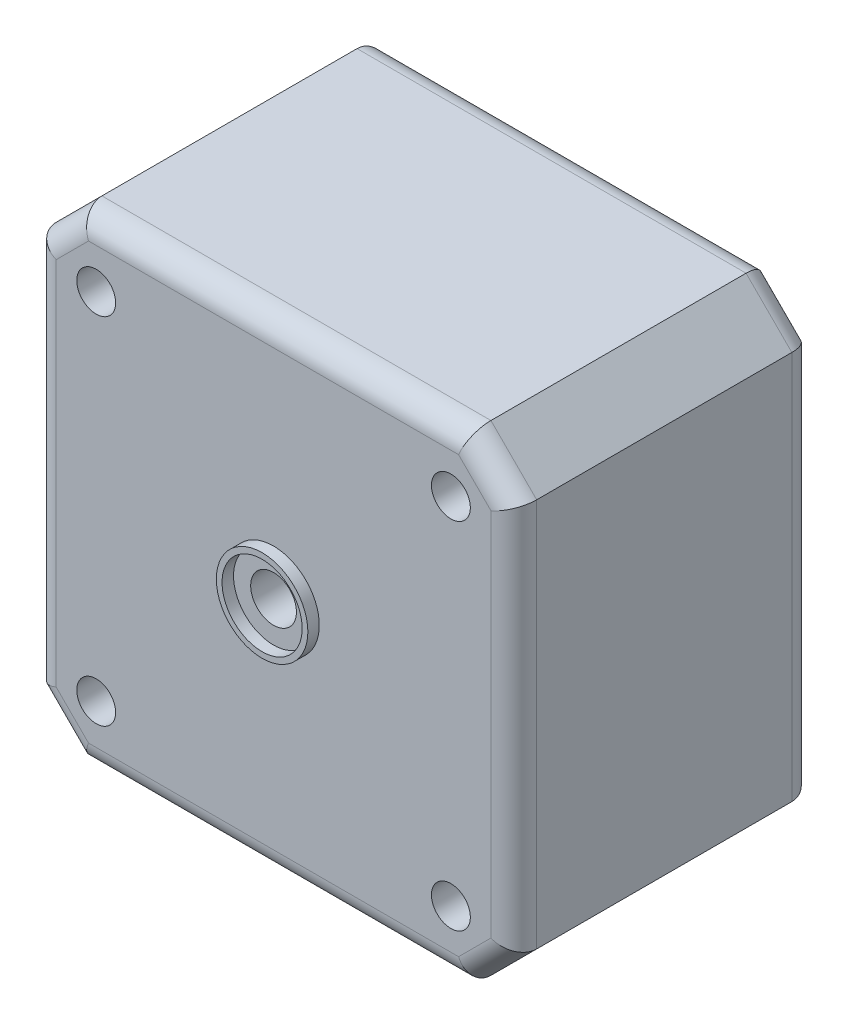
from build123d import *

# Parameters (mm, degrees)
SKETCH_4_W                  = 42
SKETCH_4_H                  = 42
EXTRUDE_2_DEPTH             = 26.3
CHAMFER_1_SIZE              = 4
FILLET_1_R                  = 2
SKETCH_5_R                  = 2
CUT_EXTRUDE_1_DEPTH         = 40.669761784
SKETCH_6_R                  = 4
SKETCH_6_R_2                = 3.5
EXTRUDE_3_DEPTH             = 1
EXTRUDE_START               = 1
SKETCH_7_R                  = 4
SKETCH_7_R_2                = 3.5
EXTRUDE_4_DEPTH             = 1
HOLE_WIZARD_M31_D           = 3.4
PATTERN_LINEAR_1_COUNT      = 2
PATTERN_LINEAR_1_PITCH      = 31
PATTERN_LINEAR_1_COUNT_DIR2 = 2
PATTERN_LINEAR_1_PITCH_DIR2 = 31


with BuildPart() as part:
    # Эскиз4 → Бобышка-Вытянуть2 (new body)
    with BuildSketch(Plane.XY):
        Rectangle(SKETCH_4_W, SKETCH_4_H)
    extrude(amount=EXTRUDE_2_DEPTH)

    # Фаска1
    chamfer_1_edges = [part.edges().sort_by_distance(p)[0] for p in [
        (21, -21, 13.15),
        (-21, -21, 13.15),
        (-21, 21, 13.15),
        (21, 21, 13.15),
    ]]
    chamfer(chamfer_1_edges, length=CHAMFER_1_SIZE)

    # Скругление1
    fillet_1_edges = [part.edges().sort_by_distance(p)[0] for p in [
        (0, -21, 0),
        (0, -21, 26.3),
        (21, 0, 0),
        (-21, 0, 0),
        (0, 21, 0),
        (-19, 19, 0),
        (19, 19, 0),
        (19, -19, 0),
        (-19, -19, 0),
        (-21, 0, 26.3),
        (21, 0, 26.3),
        (0, 21, 26.3),
        (-19, 19, 26.3),
        (19, 19, 26.3),
        (19, -19, 26.3),
        (-19, -19, 26.3),
    ]]
    fillet(fillet_1_edges, radius=FILLET_1_R)

    # Эскиз5 → Вырез-Вытянуть1 (cut, through all)
    with BuildSketch(Plane(origin=(0, 0, 0), x_dir=(-1, 0, 0), z_dir=(0, 0, -1))):
        Circle(SKETCH_5_R)
    extrude(amount=-CUT_EXTRUDE_1_DEPTH, mode=Mode.SUBTRACT)

    # Эскиз6 → Бобышка-Вытянуть3 (add)
    with BuildSketch(Plane(origin=(0, 0, 0), x_dir=(-1, 0, 0), z_dir=(0, 0, -1))):
        Circle(SKETCH_6_R)
        Circle(SKETCH_6_R_2, mode=Mode.SUBTRACT)
    extrude(amount=EXTRUDE_3_DEPTH)

    # Эскиз7 → Бобышка-Вытянуть4 (add)
    with BuildSketch(Plane.XY.offset(26.3).offset(EXTRUDE_START)):
        with Locations(Location((0, 0, 0), (0, 0, 180))):
            Circle(SKETCH_7_R)
        with Locations(Location((0, 0, 0), (0, 0, 180))):
            Circle(SKETCH_7_R_2, mode=Mode.SUBTRACT)
    extrude(amount=-EXTRUDE_4_DEPTH)

    # Отверстие с зазором M31 (through all)
    with Locations(Plane.XY.offset(26.3)):
        with Locations((-15.5, 15.5)):
            hole_wizard_m31 = Hole(HOLE_WIZARD_M31_D / 2)

    # Линейный массив1: Hole Wizard M31 2 × 2
    with Locations(*[(i * PATTERN_LINEAR_1_PITCH, -j * PATTERN_LINEAR_1_PITCH_DIR2, 0) for i in range(PATTERN_LINEAR_1_COUNT) for j in range(PATTERN_LINEAR_1_COUNT_DIR2) if (i, j) != (0, 0)]):
        add(hole_wizard_m31, mode=Mode.SUBTRACT)


solid = part.part
